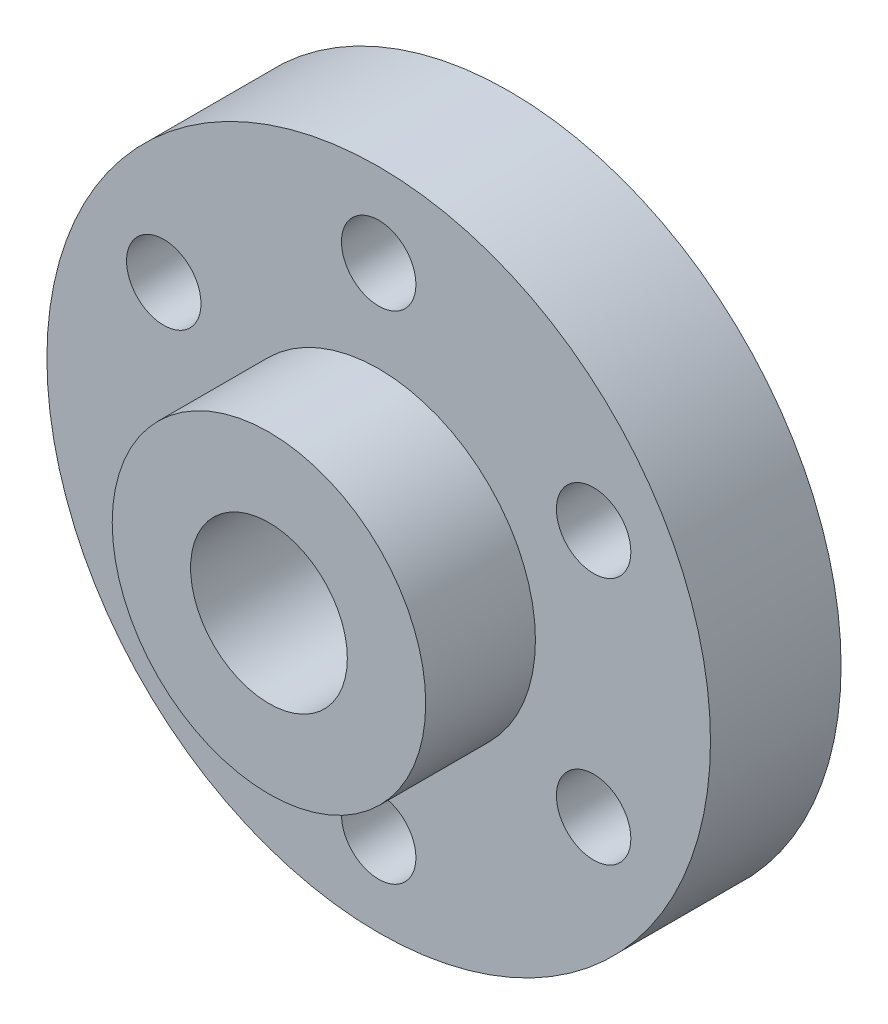
from build123d import *

# Parameters (mm, degrees)
SKETCH1_R               = 12.7
BOSS_EXTRUDE1_DEPTH     = 5
SKETCH2_R               = 6
BOSS_EXTRUDE2_DEPTH     = 4.2
CUT_EXTRUDE1_REACH      = 20.643
SKETCH3_R               = 1.425
CUT_EXTRUDE2_DEPTH      = 21.179692763
CUT_EXTRUDE2_DEPTH_BACK = 21.179692763
SKETCH4_R               = 3


with BuildPart() as part:
    # Sketch1 → Boss-Extrude1 (new body)
    with BuildSketch(Plane.XY):
        Circle(SKETCH1_R)
    extrude(amount=BOSS_EXTRUDE1_DEPTH)

    # Sketch2 → Boss-Extrude2 (add)
    with BuildSketch(Plane.XY.offset(5)):
        Circle(SKETCH2_R)
    extrude(amount=BOSS_EXTRUDE2_DEPTH)

    # Sketch3 → Cut-Extrude1 (cut, up to next)
    with BuildSketch(Plane.XY.offset(5), mode=Mode.PRIVATE) as cut_extrude1_sk1:
        with Locations((0, 9.5)):
            Circle(SKETCH3_R)
    cut_extrude1_tool1 = extrude(cut_extrude1_sk1.sketch, amount=-CUT_EXTRUDE1_REACH, mode=Mode.PRIVATE) & part.part
    # Sketch3 → Cut-Extrude1 (cut, up to next)
    with BuildSketch(Plane.XY.offset(5), mode=Mode.PRIVATE) as cut_extrude1_sk2:
        with Locations((-8.227241336, 4.75)):
            Circle(SKETCH3_R)
    cut_extrude1_tool2 = extrude(cut_extrude1_sk2.sketch, amount=-CUT_EXTRUDE1_REACH, mode=Mode.PRIVATE) & part.part
    # Sketch3 → Cut-Extrude1 (cut, up to next)
    with BuildSketch(Plane.XY.offset(5), mode=Mode.PRIVATE) as cut_extrude1_sk3:
        with Locations((-8.227241336, -4.75)):
            Circle(SKETCH3_R)
    cut_extrude1_tool3 = extrude(cut_extrude1_sk3.sketch, amount=-CUT_EXTRUDE1_REACH, mode=Mode.PRIVATE) & part.part
    # Sketch3 → Cut-Extrude1 (cut, up to next)
    with BuildSketch(Plane.XY.offset(5), mode=Mode.PRIVATE) as cut_extrude1_sk4:
        with Locations((0, -9.5)):
            Circle(SKETCH3_R)
    cut_extrude1_tool4 = extrude(cut_extrude1_sk4.sketch, amount=-CUT_EXTRUDE1_REACH, mode=Mode.PRIVATE) & part.part
    # Sketch3 → Cut-Extrude1 (cut, up to next)
    with BuildSketch(Plane.XY.offset(5), mode=Mode.PRIVATE) as cut_extrude1_sk5:
        with Locations((8.227241336, -4.75)):
            Circle(SKETCH3_R)
    cut_extrude1_tool5 = extrude(cut_extrude1_sk5.sketch, amount=-CUT_EXTRUDE1_REACH, mode=Mode.PRIVATE) & part.part
    # Sketch3 → Cut-Extrude1 (cut, up to next)
    with BuildSketch(Plane.XY.offset(5), mode=Mode.PRIVATE) as cut_extrude1_sk6:
        with Locations((8.227241336, 4.75)):
            Circle(SKETCH3_R)
    cut_extrude1_tool6 = extrude(cut_extrude1_sk6.sketch, amount=-CUT_EXTRUDE1_REACH, mode=Mode.PRIVATE) & part.part
    add(cut_extrude1_tool1.solids().sort_by_distance((0, 9.5, 5))[0], mode=Mode.SUBTRACT)
    add(cut_extrude1_tool2.solids().sort_by_distance((-8.227241, 4.75, 5))[0], mode=Mode.SUBTRACT)
    add(cut_extrude1_tool3.solids().sort_by_distance((-8.227241, -4.75, 5))[0], mode=Mode.SUBTRACT)
    add(cut_extrude1_tool4.solids().sort_by_distance((0, -9.5, 5))[0], mode=Mode.SUBTRACT)
    add(cut_extrude1_tool5.solids().sort_by_distance((8.227241, -4.75, 5))[0], mode=Mode.SUBTRACT)
    add(cut_extrude1_tool6.solids().sort_by_distance((8.227241, 4.75, 5))[0], mode=Mode.SUBTRACT)

    # Sketch4 → Cut-Extrude2 (cut, two sides: drawn at the far end of the back side and taken through both)
    with BuildSketch(Plane.XY.offset(9.2).offset(-CUT_EXTRUDE2_DEPTH_BACK)):
        Circle(SKETCH4_R)
    extrude(amount=CUT_EXTRUDE2_DEPTH + CUT_EXTRUDE2_DEPTH_BACK, mode=Mode.SUBTRACT)


solid = part.part
